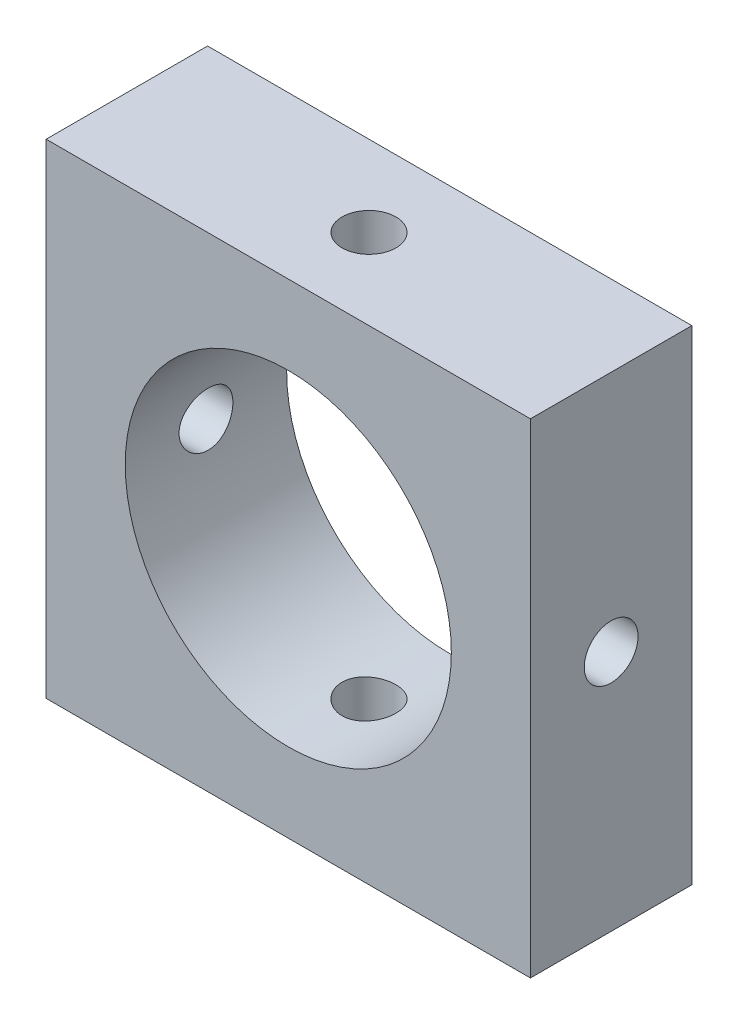
from build123d import *

# Parameters (mm, degrees)
SKETCH1_W           = 57.15
SKETCH1_H           = 57.15
BOSS_EXTRUDE1_DEPTH = 19.05
SKETCH2_R           = 19.2405
CUT_EXTRUDE1_DEPTH  = 19.05
SKETCH5_R           = 3.175
CUT_EXTRUDE2_DEPTH  = 84.037024874
SKETCH6_R           = 3.175
CUT_EXTRUDE3_DEPTH  = 84.037024966


with BuildPart() as part:
    # Sketch1 → Boss-Extrude1 (new body)
    with BuildSketch(Plane.XY):
        with Locations((28.575, 28.575)):
            Rectangle(SKETCH1_W, SKETCH1_H)
    extrude(amount=BOSS_EXTRUDE1_DEPTH)

    # Sketch2 → Cut-Extrude1 (cut)
    with BuildSketch(Plane(origin=(0, 0, 0), x_dir=(-1, 0, 0), z_dir=(0, 0, -1))):
        with Locations((-28.575, 28.575)):
            Circle(SKETCH2_R)
    extrude(amount=-CUT_EXTRUDE1_DEPTH, mode=Mode.SUBTRACT)

    # Sketch5 → Cut-Extrude2 (cut, through all)
    with BuildSketch(Plane(origin=(57.15, 0, 0), x_dir=(0, 0, -1), z_dir=(1, 0, 0))):
        with Locations((-9.525, 28.575)):
            Circle(SKETCH5_R)
    extrude(amount=-CUT_EXTRUDE2_DEPTH, mode=Mode.SUBTRACT)

    # Sketch6 → Cut-Extrude3 (cut, through all)
    with BuildSketch(Plane.XZ):
        with Locations(Location((28.575, 9.525, 0), (0, 0, 270))):
            Circle(SKETCH6_R)
    extrude(amount=-CUT_EXTRUDE3_DEPTH, mode=Mode.SUBTRACT)


solid = part.part
